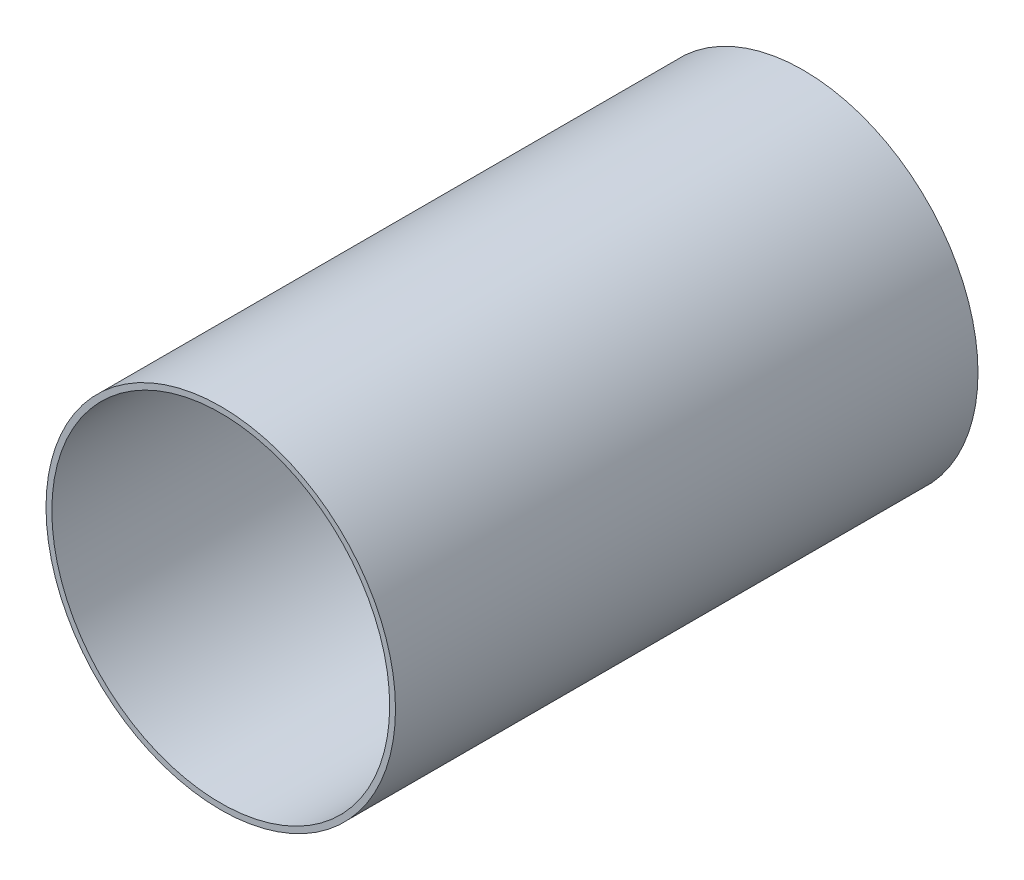
from build123d import *

# Parameters (mm, degrees)
SKETCH1_R           = 30
SKETCH1_R_2         = 29
BOSS_EXTRUDE1_DEPTH = 100


with BuildPart() as part:
    # Sketch1 → Boss-Extrude1 (new body)
    with BuildSketch(Plane.XY):
        Circle(SKETCH1_R)
        Circle(SKETCH1_R_2, mode=Mode.SUBTRACT)
    extrude(amount=BOSS_EXTRUDE1_DEPTH)


solid = part.part
